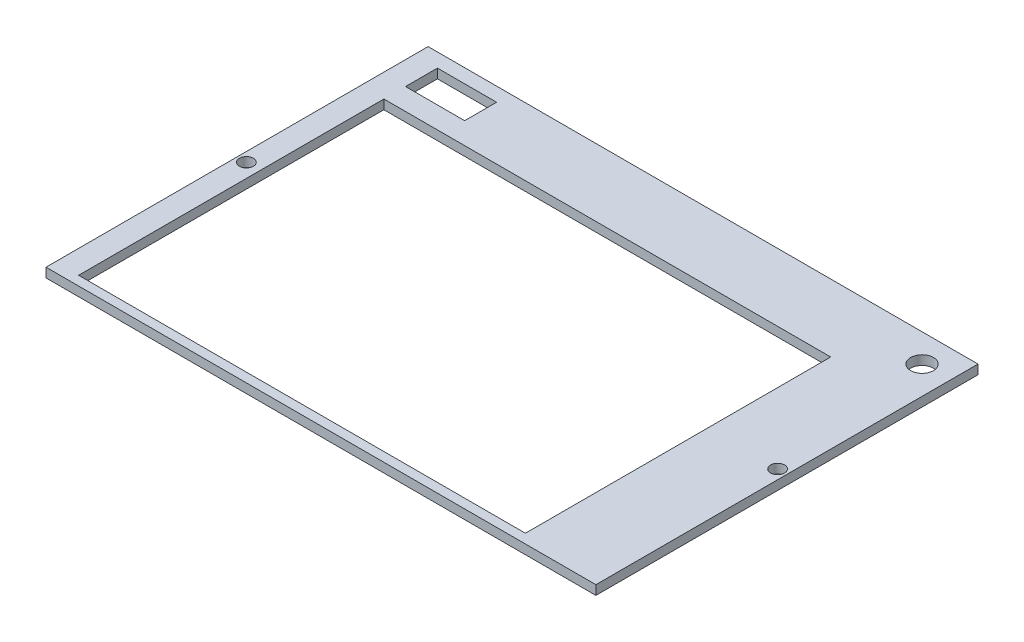
from build123d import *

# Parameters (mm, degrees)
SKETCH1_W           = 118
SKETCH1_H           = 82
BOSS_EXTRUDE1_DEPTH = 2
SKETCH2_R           = 2.45
SKETCH2_W           = 95.88
SKETCH2_H           = 65.51
SKETCH2_W_2         = 12.69
SKETCH2_H_2         = 6.85
CUT_EXTRUDE4_DEPTH  = 10
SKETCH3_R           = 1.5
CUT_EXTRUDE7_DEPTH  = 10


with BuildPart() as part:
    # Sketch1 → Boss-Extrude1 (new body)
    with BuildSketch(Plane(origin=(0, 0, 0), x_dir=(1, 0, 0), z_dir=(0, 1, 0))):
        Rectangle(SKETCH1_W, SKETCH1_H)
    extrude(amount=BOSS_EXTRUDE1_DEPTH)

    # Sketch2 → Cut-Extrude4 (cut)
    with BuildSketch(Plane(origin=(0, 2, 0), x_dir=(1, 0, 0), z_dir=(0, 1, 0))):
        with Locations(Location((53, 35, 0), (0, 0, 270))):
            Circle(SKETCH2_R)
        with Locations((-6.06, -6.245)):
            Rectangle(SKETCH2_W, SKETCH2_H)
        with Locations((-47.655, 34.575)):
            Rectangle(SKETCH2_W_2, SKETCH2_H_2)
    extrude(amount=-CUT_EXTRUDE4_DEPTH, mode=Mode.SUBTRACT)

    # Sketch3 → Cut-Extrude7 (cut)
    with BuildSketch(Plane(origin=(0, 2, 0), x_dir=(1, 0, 0), z_dir=(0, 1, 0))):
        with Locations(Location((57, 0, 0), (0, 0, 270))):
            Circle(SKETCH3_R)
        with Locations(Location((-57, 0, 0), (0, 0, 270))):
            Circle(SKETCH3_R)
    extrude(amount=-CUT_EXTRUDE7_DEPTH, mode=Mode.SUBTRACT)


solid = part.part
